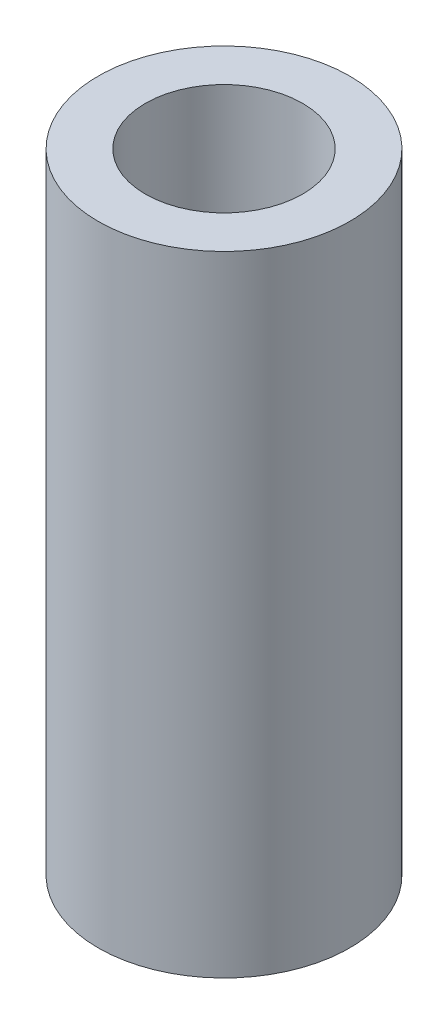
from build123d import *

# Parameters (mm, degrees)
SKETCH1_R           = 2
BOSS_EXTRUDE1_DEPTH = 10
SKETCH2_R           = 1.25
CUT_EXTRUDE1_DEPTH  = 11.392304845


with BuildPart() as part:
    # Sketch1 → Boss-Extrude1 (new body)
    with BuildSketch(Plane(origin=(0, 0, 0), x_dir=(1, 0, 0), z_dir=(0, 1, 0))):
        with Locations(Location((0, 0, 0), (0, 0, 270))):
            Circle(SKETCH1_R)
    extrude(amount=BOSS_EXTRUDE1_DEPTH)

    # Sketch2 → Cut-Extrude1 (cut, through all)
    with BuildSketch(Plane.XZ):
        with Locations(Location((0, 0, 0), (0, 0, 270))):
            Circle(SKETCH2_R)
    extrude(amount=-CUT_EXTRUDE1_DEPTH, mode=Mode.SUBTRACT)


solid = part.part
